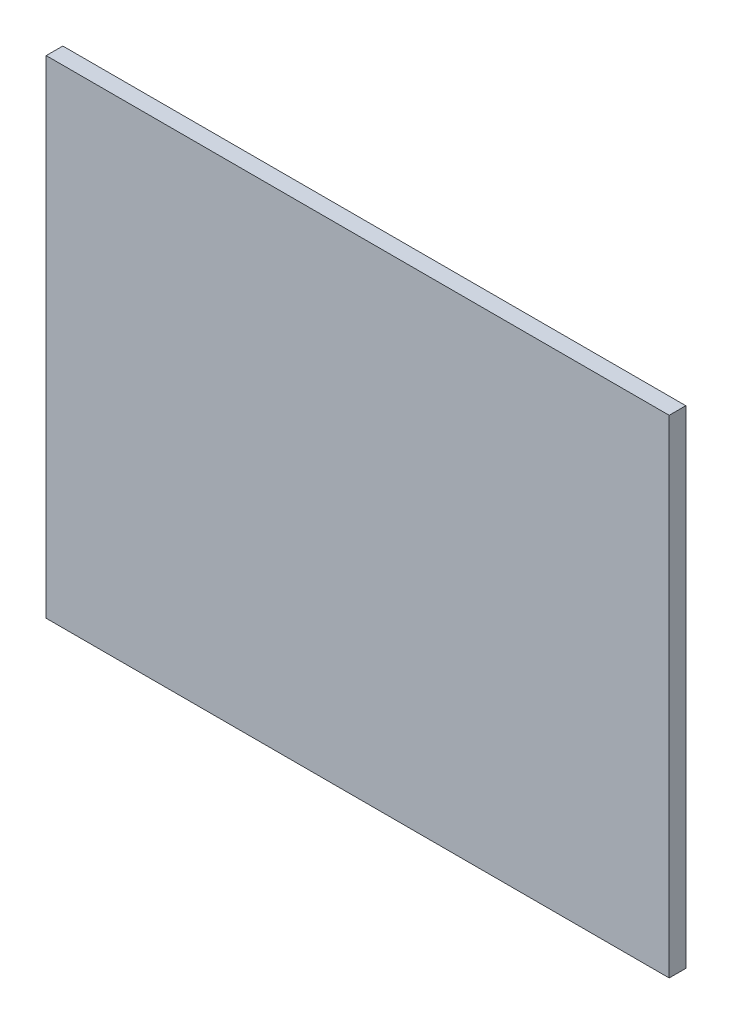
from build123d import *

# Parameters (mm, degrees)
SKETCH1_W           = 225
SKETCH1_H           = 176
BOSS_EXTRUDE1_DEPTH = 6


with BuildPart() as part:
    # Sketch1 → Boss-Extrude1 (new body)
    with BuildSketch(Plane.XY):
        Rectangle(SKETCH1_W, SKETCH1_H)
    extrude(amount=BOSS_EXTRUDE1_DEPTH)


solid = part.part
